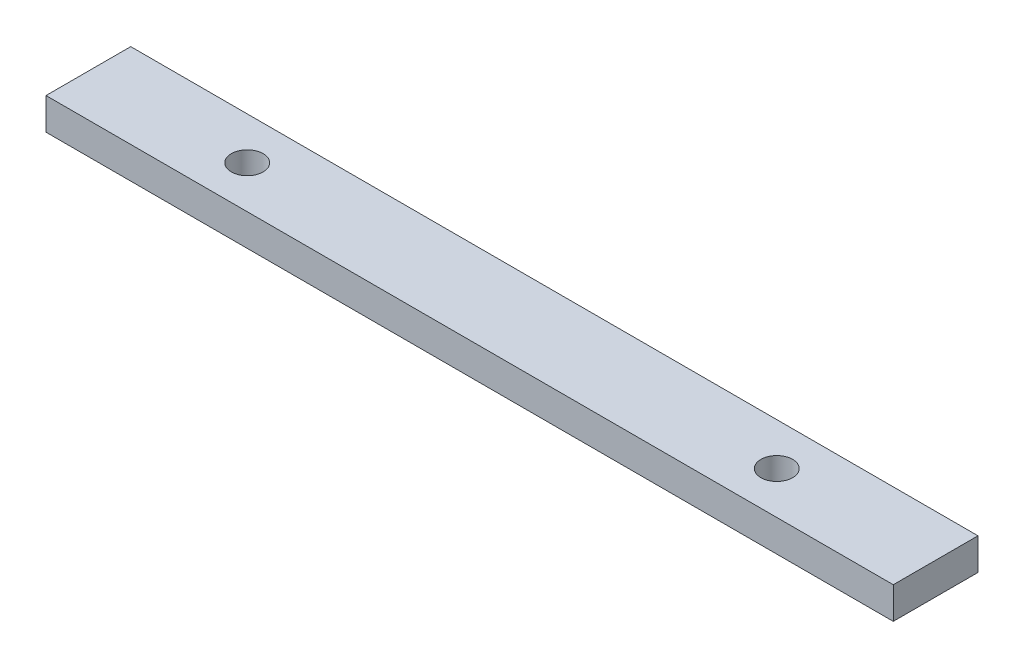
from build123d import *

# Parameters (mm, degrees)
CROQUIS1_W              = 80
CROQUIS1_H              = 8
CROQUIS1_R              = 1.5
SALIENTE_EXTRUIR1_DEPTH = 3


with BuildPart() as part:
    # Croquis1 → Saliente-Extruir1 (new body)
    with BuildSketch(Plane(origin=(0, 0, 0), x_dir=(1, 0, 0), z_dir=(0, 1, 0))):
        Rectangle(CROQUIS1_W, CROQUIS1_H)
        with Locations(Location((25, 0, 0), (0, 0, 270))):
            Circle(CROQUIS1_R, mode=Mode.SUBTRACT)
        with Locations(Location((-25, 0, 0), (0, 0, 270))):
            Circle(CROQUIS1_R, mode=Mode.SUBTRACT)
    extrude(amount=SALIENTE_EXTRUIR1_DEPTH)


solid = part.part
